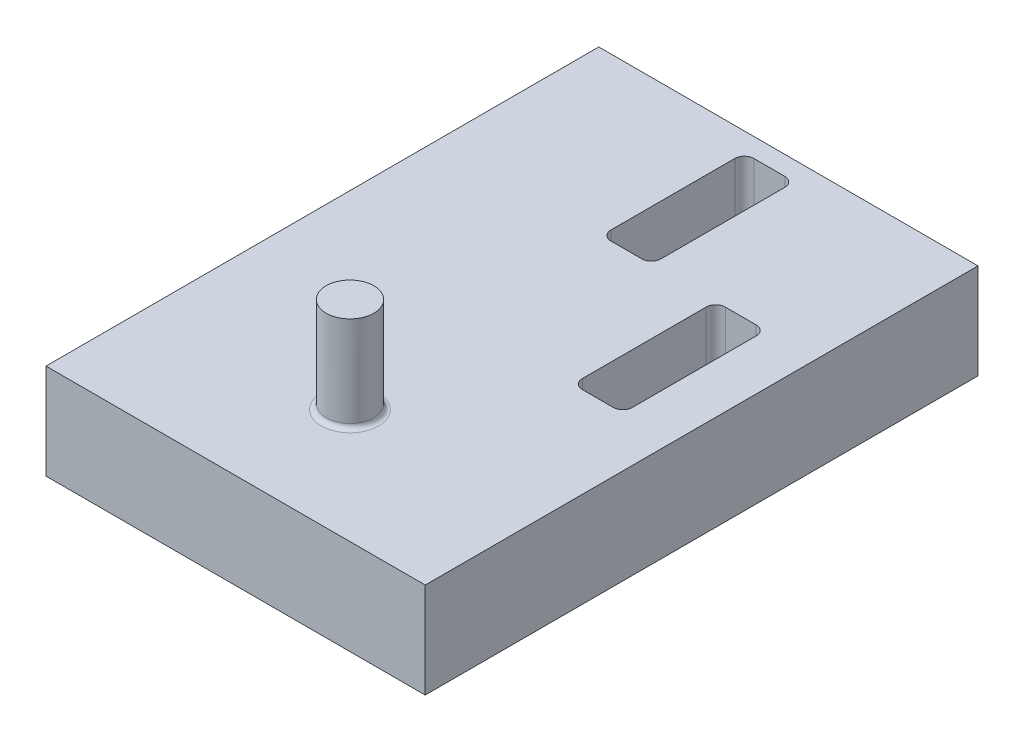
from build123d import *

# Parameters (mm, degrees)
BOSS_EXTRUDE1_DEPTH  = 10
FILLET2_R            = 1
FILLET2_OF_MIRROR1_R = 1
CUT_EXTRUDE1_DEPTH   = 81.635062113
FILLET3_R            = 1
SKETCH5_R            = 2.5
BOSS_EXTRUDE2_DEPTH  = 10
FILLET1_R            = 0.5
SKETCH6_W            = 39.78759817
SKETCH6_H            = 34
CUT_EXTRUDE2_DEPTH   = 10


with BuildPart() as part:
    # Sketch2 → Boss-Extrude1 (new body)
    with BuildSketch(Plane(origin=(0, 0, 0), x_dir=(1, 0, 0), z_dir=(0, 1, 0))):
        Polygon((-19.893799085, 77.5), (0, 77.5), (0, 75.5), (-2.625, 75.5), (-2.625, 73), (-2.625, 63), (-2.625, 60.5), (0, 60.5), (0, 60.375), (0, 2.5), (-2.625, 2.5), (-2.625, 0), (-2.625, -10), (-2.625, -12.5), (0, -12.5), (0, -14.5), (-19.893799085, -14.5), align=None)
    boss_extrude1 = extrude(amount=BOSS_EXTRUDE1_DEPTH)

    # Fillet2
    fillet2_edges = [part.edges().sort_by_distance(p)[0] for p in [
        (-2.625, 5, 12.5),
        (-2.625, 5, -2.5),
        (-2.625, 5, -60.5),
        (-2.625, 5, -75.5),
    ]]
    fillet(fillet2_edges, radius=FILLET2_R)

    # Mirror1: Boss-Extrude1 across Right Plane
    add(boss_extrude1.mirror(Plane(origin=(0, 0, 0), x_dir=(0, 0, -1), z_dir=(1, 0, 0))))

    # Fillet2 of Mirror1
    fillet2_of_mirror1_edges = [part.edges().sort_by_distance(p)[0] for p in [
        (2.625, 5, 12.5),
        (2.625, 5, -2.5),
        (2.625, 5, -60.5),
        (2.625, 5, -75.5),
    ]]
    fillet(fillet2_of_mirror1_edges, radius=FILLET2_OF_MIRROR1_R)

    # Sketch4 → Cut-Extrude1 (cut, through all)
    with BuildSketch(Plane(origin=(0, 0, 0), x_dir=(1, 0, 0), z_dir=(0, 1, 0))):
        Polygon((-14.625, 15), (-14.625, 5), (-14.625, 2.5), (-12, 2.5), (-9.375, 2.5), (-9.375, 5), (-9.375, 15), (-9.375, 17.5), (-12, 17.5), (-14.625, 17.5), align=None)
        Polygon((9.375, 58), (9.375, 48), (9.375, 45.5), (12, 45.5), (14.625, 45.5), (14.625, 48), (14.625, 58), (14.625, 60.5), (12, 60.5), (9.375, 60.5), align=None)
    extrude(amount=CUT_EXTRUDE1_DEPTH, mode=Mode.SUBTRACT)

    # Fillet3
    fillet3_edges = [part.edges().sort_by_distance(p)[0] for p in [
        (-14.625, 5, -17.5),
        (-14.625, 5, -2.5),
        (-9.375, 5, -2.5),
        (-9.375, 5, -17.5),
        (14.625, 5, -60.5),
        (9.375, 5, -60.5),
        (9.375, 5, -45.5),
        (14.625, 5, -45.5),
    ]]
    fillet(fillet3_edges, radius=FILLET3_R)

    # Sketch5 → Boss-Extrude2 (add)
    with BuildSketch(Plane(origin=(0, 10, 0), x_dir=(1, 0, 0), z_dir=(0, 1, 0))):
        with Locations(Location((0, 31.5, 0), (0, 0, 90))):
            Circle(SKETCH5_R)
    extrude(amount=BOSS_EXTRUDE2_DEPTH)

    # Fillet1
    fillet1_edges = [part.edges().sort_by_distance(p)[0] for p in [
        (0, 10, -29),
    ]]
    fillet(fillet1_edges, radius=FILLET1_R)

    # Sketch6 → Cut-Extrude2 (cut)
    with BuildSketch(Plane(origin=(0, 10, 0), x_dir=(1, 0, 0), z_dir=(0, 1, 0))):
        with Locations((0, 2.5)):
            Rectangle(SKETCH6_W, SKETCH6_H)
    extrude(amount=-CUT_EXTRUDE2_DEPTH, mode=Mode.SUBTRACT)


solid = part.part
